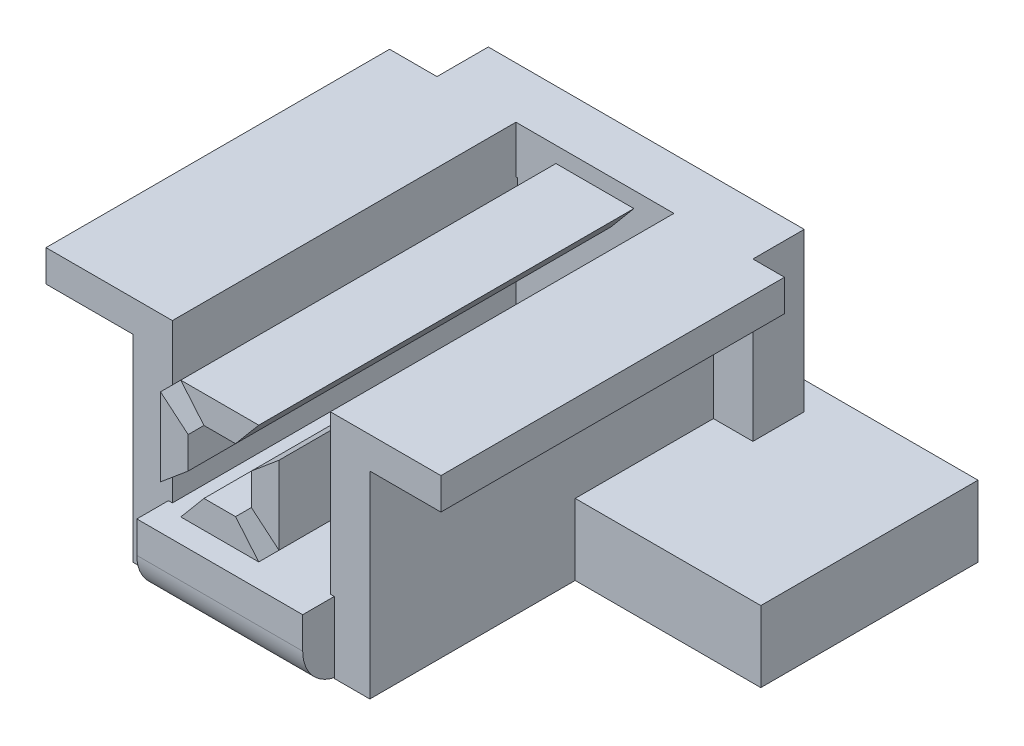
from build123d import *

# Parameters (mm, degrees)
BOSS_EXTRUDE2_DEPTH          = 8
BOSS_EXTRUDE2_DEPTH_BACK     = 1
SKETCH1_R                    = 2.5
CUT_EXTRUDE1_DEPTH           = 79.300702423
CUT_EXTRUDE1_DEPTH_BACK      = 79.300702423
SKETCH2_R                    = 2.5
SKETCH3_R                    = 3.25
CUT_EXTRUDE5_DEPTH           = 15
CUT_EXTRUDE5_DRAFT           = -0.0573
CUT_EXTRUDE5_PROFILE_2_DEPTH = 15
CUT_EXTRUDE5_PROFILE_2_DRAFT = -0.0573
SKETCH5_W                    = 4.5
SKETCH5_H                    = 6.5
BOSS_EXTRUDE3_DEPTH          = 14.5
SKETCH6_R                    = 4
CUT_EXTRUDE4_DEPTH           = 1.5
SKETCH12_W                   = 10.5
SKETCH12_H                   = 30
BOSS_EXTRUDE7_DEPTH          = 9
SKETCH15_W                   = 9
SKETCH15_H                   = 6.5
BOSS_EXTRUDE8_DEPTH          = 3.5
BOSS_EXTRUDE9_DEPTH          = 54
FILLET4_R                    = 5
SKETCH18_W                   = 9.873697418
SKETCH18_H                   = 6.5
BOSS_EXTRUDE11_DEPTH         = 0.5
SKETCH20_W                   = 4
SKETCH20_H                   = 17.5
BOSS_EXTRUDE12_DEPTH         = 18
BOSS_EXTRUDE13_DEPTH         = 11
BOSS_EXTRUDE13_DEPTH_BACK    = 4
SKETCH22_W                   = 17.5
SKETCH22_H                   = 4
SKETCH25_W                   = 2
SKETCH25_H                   = 17.5
BOSS_EXTRUDE14_DEPTH         = 41
SKETCH28_W                   = 41
SKETCH28_H                   = 45
BOSS_EXTRUDE15_DEPTH         = 2
SKETCH29_R                   = 1.75
CUT_EXTRUDE8_DEPTH           = 9
BOSS_EXTRUDE16_DEPTH         = 9
BOSS_EXTRUDE16_DEPTH_BACK    = 4
SKETCH30_W                   = 17.5
SKETCH30_H                   = 2
CUT_EXTRUDE9_DEPTH           = 9
SKETCH32_W                   = 13
SKETCH32_H                   = 4
BOSS_EXTRUDE17_DEPTH         = 23.5
SKETCH33_W                   = 0.5
SKETCH33_H                   = 17.5
BOSS_EXTRUDE18_DEPTH         = 20
SKETCH34_W                   = 4.5
SKETCH34_H                   = 25
SKETCH34_W_2                 = 15.5
SKETCH34_H_2                 = 4
SKETCH34_W_3                 = 9
BOSS_EXTRUDE19_DEPTH         = 26
SKETCH35_W                   = 9.873697418
SKETCH35_H                   = 0.5
BOSS_EXTRUDE20_DEPTH         = 47.5
BOSS_EXTRUDE21_DEPTH         = 47.5
SKETCH38_W                   = 0.419549816
SKETCH38_H                   = 18.5
CUT_EXTRUDE10_DEPTH          = 90.5
SKETCH39_W                   = 4
SKETCH39_H                   = 4
BOSS_EXTRUDE23_DEPTH         = 47.5
SKETCH46_W                   = 22.5
SKETCH46_H                   = 9
SKETCH46_W_2                 = 5
BOSS_EXTRUDE26_DEPTH         = 11.5
SKETCH47_W                   = 27.5
SKETCH47_H                   = 9
BOSS_EXTRUDE27_DEPTH         = 11
SKETCH48_W                   = 5
SKETCH48_H                   = 6.5
BOSS_EXTRUDE31_DEPTH         = 18.5
SKETCH50_R                   = 4
CUT_EXTRUDE11_DEPTH          = 1.5
SKETCH51_W                   = 9.626242636
SKETCH51_H                   = 9.125298808
BOSS_EXTRUDE32_DEPTH         = 1.5
BOSS_EXTRUDE35_DEPTH         = 47.5
SKETCH55_W                   = 9.873697418
SKETCH55_H                   = 0.5
CUT_EXTRUDE12_DEPTH          = 47.5
SKETCH56_W                   = 0.5
SKETCH56_H                   = 20
BOSS_EXTRUDE36_DEPTH         = 43.5
BOSS_EXTRUDE37_DEPTH         = 47.5
SKETCH58_W                   = 0.715052156
SKETCH58_H                   = 9.51279705
CUT_EXTRUDE13_DEPTH          = 4
CUT_EXTRUDE15_DEPTH          = 47.5
SKETCH60_W                   = 0.215052156
SKETCH60_H                   = 9.51279705
CUT_EXTRUDE16_DEPTH          = 47.5
CUT_EXTRUDE17_DEPTH          = 47.5
SKETCH62_W                   = 8
SKETCH62_H                   = 8
CUT_EXTRUDE18_DEPTH          = 47.5
SKETCH63_W                   = 13
SKETCH63_H                   = 4
CUT_EXTRUDE20_DEPTH          = 17
SKETCH64_W                   = 1
SKETCH64_H                   = 1.5
BOSS_EXTRUDE38_DEPTH         = 6.5
CUT_EXTRUDE22_DEPTH          = 9
FILLET6_R                    = 5
BOSS_EXTRUDE39_DEPTH         = 11
BOSS_EXTRUDE39_DEPTH_BACK    = 10
SKETCH67_W                   = 27.5
SKETCH67_H                   = 9
SKETCH68_W                   = 2
SKETCH68_H                   = 45
CUT_EXTRUDE23_DEPTH          = 17
SKETCH69_W                   = 2
SKETCH69_H                   = 41
CUT_EXTRUDE24_DEPTH          = 37
SKETCH70_W                   = 6
SKETCH70_H                   = 2.5
CUT_EXTRUDE25_DEPTH          = 6.5
SKETCH71_W                   = 40
SKETCH71_H                   = 6.5
BOSS_EXTRUDE40_DEPTH         = 1.5


with BuildPart() as part:
    # Sketch1 → Boss-Extrude2 (new, two sides: drawn at the far end of the back side and taken through both)
    with BuildSketch(Plane(origin=(0, 0, 0), x_dir=(1, 0, 0), z_dir=(0, 1, 0)).offset(-BOSS_EXTRUDE2_DEPTH_BACK)):
        with BuildLine():
            Line((5, 0), (50, 0))
            ThreePointArc((50, 0), (53.535533906, 1.464466094), (55, 5))
            Line((55, 5), (55, 50))
            ThreePointArc((55, 50), (53.535533906, 53.535533906), (50, 55))
            Line((50, 55), (5, 55))
            ThreePointArc((5, 55), (1.464466094, 53.535533906), (0, 50))
            Line((0, 50), (0, 5))
            ThreePointArc((0, 5), (1.464466094, 1.464466094), (5, 0))
        make_face()
        with Locations(Location((7.5, 47.5, 0), (0, 0, 270))):
            Circle(SKETCH1_R, mode=Mode.SUBTRACT)
        with Locations(Location((47.5, 47.5, 0), (0, 0, 270))):
            Circle(SKETCH1_R, mode=Mode.SUBTRACT)
        with Locations(Location((47.5, 7.5, 0), (0, 0, 270))):
            Circle(SKETCH1_R, mode=Mode.SUBTRACT)
        with Locations(Location((7.5, 7.5, 0), (0, 0, 270))):
            Circle(SKETCH1_R, mode=Mode.SUBTRACT)
    extrude(amount=BOSS_EXTRUDE2_DEPTH + BOSS_EXTRUDE2_DEPTH_BACK)

    # Sketch2 → Cut-Extrude1 (cut, two sides: drawn at the far end of the back side and taken through both)
    with BuildSketch(Plane(origin=(0, 8, 0), x_dir=(1, 0, 0), z_dir=(0, 1, 0)).offset(-CUT_EXTRUDE1_DEPTH_BACK)):
        with BuildLine():
            Line((0, 50), (0, 27.5))
            Line((0, 27.5), (55, 27.5))
            Line((55, 27.5), (55, 50))
            ThreePointArc((55, 50), (53.535533906, 53.535533906), (50, 55))
            Line((50, 55), (5, 55))
            ThreePointArc((5, 55), (1.464466094, 53.535533906), (0, 50))
        make_face()
        with Locations((7.5, 47.5)):
            Circle(SKETCH2_R, mode=Mode.SUBTRACT)
        with Locations((47.5, 47.5)):
            Circle(SKETCH2_R, mode=Mode.SUBTRACT)
    extrude(amount=CUT_EXTRUDE1_DEPTH + CUT_EXTRUDE1_DEPTH_BACK, mode=Mode.SUBTRACT)


with BuildPart() as cut_extrude5_tool:
    # Sketch3 → Cut-Extrude5 (with draft: the straight prism first)
    with BuildSketch(Plane(origin=(0, 0, -27.5), x_dir=(-1, 0, 0), z_dir=(0, 0, -1))):
        with Locations((-37.5, 3.5)):
            Circle(SKETCH3_R)
    extrude(amount=-CUT_EXTRUDE5_DEPTH)
    # Cut-Extrude5: the draft: its side faces are tilted about the plane it starts from
    cut_extrude5_sides = [cut_extrude5_tool.faces().sort_by_distance(p)[0] for p in [
        (40.75, 3.5, -20),
    ]]
    draft(cut_extrude5_sides, Plane(origin=(0, 0, -27.5), x_dir=(-1, 0, 0), z_dir=(0, 0, -1)), CUT_EXTRUDE5_DRAFT)


with BuildPart() as part_1:
    add(part.part)

    # Cut-Extrude5: cut by cut_extrude5_tool
    add(cut_extrude5_tool.part, mode=Mode.SUBTRACT)


with BuildPart() as cut_extrude5_profile_2_tool:
    # Sketch3 → Cut-Extrude5 profile 2 (with draft: the straight prism first)
    with BuildSketch(Plane(origin=(0, 0, -27.5), x_dir=(-1, 0, 0), z_dir=(0, 0, -1))):
        with Locations((-17.5, 3.5)):
            Circle(SKETCH3_R)
    extrude(amount=-CUT_EXTRUDE5_PROFILE_2_DEPTH)
    # Cut-Extrude5 profile 2: the draft: its side faces are tilted about the plane it starts from
    cut_extrude5_profile_2_sides = [cut_extrude5_profile_2_tool.faces().sort_by_distance(p)[0] for p in [
        (20.75, 3.5, -20),
    ]]
    draft(cut_extrude5_profile_2_sides, Plane(origin=(0, 0, -27.5), x_dir=(-1, 0, 0), z_dir=(0, 0, -1)), CUT_EXTRUDE5_PROFILE_2_DRAFT)


with BuildPart() as part_2:
    add(part_1.part)

    # Cut-Extrude5 profile 2: cut by cut_extrude5_profile_2_tool
    add(cut_extrude5_profile_2_tool.part, mode=Mode.SUBTRACT)

    # Sketch5 → Boss-Extrude3 (add)
    with BuildSketch(Plane(origin=(0, 8, 0), x_dir=(1, 0, 0), z_dir=(0, 1, 0))):
        with Locations((25.25, 20.75)):
            Rectangle(SKETCH5_W, SKETCH5_H)
        with Locations((29.75, 20.75)):
            Rectangle(SKETCH5_W, SKETCH5_H)
    extrude(amount=BOSS_EXTRUDE3_DEPTH)

    # Sketch6 → Cut-Extrude4 (cut)
    with BuildSketch(Plane(origin=(0, 0, -24), x_dir=(-1, 0, 0), z_dir=(0, 0, -1))):
        with Locations((-27.5, 17)):
            Circle(SKETCH6_R)
    extrude(amount=-CUT_EXTRUDE4_DEPTH, mode=Mode.SUBTRACT)

    # Sketch12 → Boss-Extrude7 (add)
    with BuildSketch(Plane(origin=(0, 8, 0), x_dir=(1, 0, 0), z_dir=(0, 1, 0))):
        with Locations((32.75, -15)):
            Rectangle(SKETCH12_W, SKETCH12_H)
        with Locations((22.25, -15)):
            Rectangle(SKETCH12_W, SKETCH12_H)
    extrude(amount=-BOSS_EXTRUDE7_DEPTH)

    # Sketch15 → Boss-Extrude8 (add)
    with BuildSketch(Plane(origin=(0, 22.5, 0), x_dir=(1, 0, 0), z_dir=(0, 1, 0))):
        with Locations((27.5, 20.75)):
            Rectangle(SKETCH15_W, SKETCH15_H)
    extrude(amount=BOSS_EXTRUDE8_DEPTH)

    # Sketch11 → Boss-Extrude9 (add)
    with BuildSketch(Plane(origin=(0, 0, -24), x_dir=(-1, 0, 0), z_dir=(0, 0, -1))):
        Polygon((-32.436848709, 26), (-29.5, 22.5), (-29.5, 26), align=None)
        Polygon((-29.5, 22.5), (-27.5, 22.5), (-25.5, 22.5), (-25.5, 26), (-29.5, 26), align=None)
        Polygon((-25.5, 26), (-25.5, 22.5), (-22.563151291, 26), align=None)
    extrude(amount=-BOSS_EXTRUDE9_DEPTH)

    # Fillet4
    fillet4_edges = [part_2.edges().sort_by_distance(p)[0] for p in [
        (27.5, -1, 30),
    ]]
    fillet(fillet4_edges, radius=FILLET4_R)

    # Sketch18 → Boss-Extrude11 (add)
    with BuildSketch(Plane(origin=(0, 26, 0), x_dir=(1, 0, 0), z_dir=(0, 1, 0))):
        with Locations((27.5, 20.75)):
            Rectangle(SKETCH18_W, SKETCH18_H)
    extrude(amount=BOSS_EXTRUDE11_DEPTH)

    # Sketch20 → Boss-Extrude12 (add)
    with BuildSketch(Plane(origin=(0, 8, 0), x_dir=(1, 0, 0), z_dir=(0, 1, 0))):
        with Locations((14.5, 8.75)):
            Rectangle(SKETCH20_W, SKETCH20_H)
        with Locations((40.5, 8.75)):
            Rectangle(SKETCH20_W, SKETCH20_H)
    extrude(amount=BOSS_EXTRUDE12_DEPTH)

    # Sketch22 → Boss-Extrude13 (add, two sides: drawn at the far end of the back side and taken through both)
    with BuildSketch(Plane.ZY.offset(-12.5).offset(-BOSS_EXTRUDE13_DEPTH_BACK)):
        with Locations((-8.75, 26)):
            Rectangle(SKETCH22_W, SKETCH22_H)
    extrude(amount=BOSS_EXTRUDE13_DEPTH + BOSS_EXTRUDE13_DEPTH_BACK)

    # Sketch25 → Boss-Extrude14 (add)
    with BuildSketch(Plane(origin=(0, 28, 0), x_dir=(1, 0, 0), z_dir=(0, 1, 0))):
        with Locations((2.5, 8.75)):
            Rectangle(SKETCH25_W, SKETCH25_H)
    extrude(amount=BOSS_EXTRUDE14_DEPTH)

    # Sketch28 → Boss-Extrude15 (add)
    with BuildSketch(Plane.ZY.offset(-1.5)):
        with Locations((-20.5, 46.5)):
            Rectangle(SKETCH28_W, SKETCH28_H)
    extrude(amount=-BOSS_EXTRUDE15_DEPTH)

    # Sketch29 → Cut-Extrude8 (cut)
    with BuildSketch(Plane.ZY.offset(-1.5)):
        with Locations((-36, 33)):
            Circle(SKETCH29_R)
        with Locations((-5, 64)):
            Circle(SKETCH29_R)
        with Locations((-5, 33)):
            Circle(SKETCH29_R)
        with Locations((-36, 64)):
            Circle(SKETCH29_R)
    extrude(amount=-CUT_EXTRUDE8_DEPTH, mode=Mode.SUBTRACT)

    # Sketch30 → Boss-Extrude16 (add, two sides: drawn at the far end of the back side and taken through both)
    with BuildSketch(Plane(origin=(42.5, 0, 0), x_dir=(0, 0, -1), z_dir=(1, 0, 0)).offset(-BOSS_EXTRUDE16_DEPTH_BACK)):
        with Locations((8.75, 25)):
            Rectangle(SKETCH30_W, SKETCH30_H)
        with Locations((8.75, 27)):
            Rectangle(SKETCH30_W, SKETCH30_H)
    extrude(amount=BOSS_EXTRUDE16_DEPTH + BOSS_EXTRUDE16_DEPTH_BACK)

    # Sketch31 → Cut-Extrude9 (cut)
    with BuildSketch(Plane(origin=(3.5, 0, 0), x_dir=(0, 0, -1), z_dir=(1, 0, 0))):
        with BuildLine():
            ThreePointArc((30.5, 47), (27.571067812, 54.071067812), (20.5, 57))
            Line((20.5, 57), (20.5, 47))
            Line((20.5, 47), (30.5, 47))
        make_face()
        with BuildLine():
            Line((20.5, 47), (20.5, 57))
            ThreePointArc((20.5, 57), (13.428932188, 39.928932188), (30.5, 47))
            Line((30.5, 47), (20.5, 47))
        make_face()
    extrude(amount=-CUT_EXTRUDE9_DEPTH, mode=Mode.SUBTRACT)

    # Sketch32 → Boss-Extrude17 (add)
    with BuildSketch(Plane(origin=(0, 0, -17.5), x_dir=(-1, 0, 0), z_dir=(0, 0, -1))):
        with Locations((-10, 26)):
            Rectangle(SKETCH32_W, SKETCH32_H)
    extrude(amount=BOSS_EXTRUDE17_DEPTH)

    # Sketch33 → Boss-Extrude18 (add)
    with BuildSketch(Plane(origin=(0, 8, 0), x_dir=(1, 0, 0), z_dir=(0, 1, 0))):
        with Locations((38.25, 8.75)):
            Rectangle(SKETCH33_W, SKETCH33_H)
        with Locations((16.75, 8.75)):
            Rectangle(SKETCH33_W, SKETCH33_H)
    extrude(amount=BOSS_EXTRUDE18_DEPTH)

    # Sketch34 → Boss-Extrude19 (add)
    with BuildSketch(Plane.XY):
        with Locations((14.75, 11.5)):
            Rectangle(SKETCH34_W, SKETCH34_H)
        with Locations((9.25, 26)):
            Rectangle(SKETCH34_W_2, SKETCH34_H_2)
        Polygon((42.5, 24), (42.5, 28), (38, 28), (38, 8), (38, -1), (42.5, -1), (42.5, 8), align=None)
        with Locations((47, 26)):
            Rectangle(SKETCH34_W_3, SKETCH34_H_2)
    extrude(amount=BOSS_EXTRUDE19_DEPTH)

    # Sketch35 → Boss-Extrude20 (add)
    with BuildSketch(Plane.XY.offset(-17.5)):
        with Locations((27.5, 26.25)):
            Rectangle(SKETCH35_W, SKETCH35_H)
    extrude(amount=BOSS_EXTRUDE20_DEPTH)

    # Sketch37 → Boss-Extrude21 (add)
    with BuildSketch(Plane.XY.offset(-17.5)):
        Polygon((23, 8), (25.5, 8), (25.5, 12), (23, 9.020616019), align=None)
        Polygon((25.5, 8), (27.5, 8), (29.5, 8), (29.5, 12), (25.5, 12), align=None)
        Polygon((29.5, 12), (29.5, 8), (32, 8), (32, 9.020616019), align=None)
        Polygon((29.5, 8), (27.5, 8), (25.5, 8), (23, 8), (23, 9.020616019), (21.863844179, 7.666598237), (33.136155821, 7.666598237), (32, 9.020616019), (32, 8), align=None)
    extrude(amount=BOSS_EXTRUDE21_DEPTH)

    # Sketch38 → Cut-Extrude10 (cut)
    with BuildSketch(Plane.XY.offset(30)):
        with Locations((22.353376383, 17.25)):
            Rectangle(SKETCH38_W, SKETCH38_H)
        with Locations((32.646623617, 17.25)):
            Rectangle(SKETCH38_W, SKETCH38_H)
    extrude(amount=-CUT_EXTRUDE10_DEPTH, mode=Mode.SUBTRACT)

    # Sketch39 → Boss-Extrude23 (add)
    with BuildSketch(Plane.XY.offset(30)):
        Polygon((21, 19.25), (17.715052156, 22.006398525), (17, 22.006398525), (17, 19.25), align=None)
        with Locations((19, 17.25)):
            Rectangle(SKETCH39_W, SKETCH39_H)
        Polygon((17.715052156, 12.493601475), (21, 15.25), (17, 15.25), (17, 12.493601475), align=None)
        Polygon((37.284947844, 12.493601475), (38, 12.493601475), (38, 15.25), (34, 15.25), align=None)
        Polygon((38, 17.25), (38, 19.25), (34, 19.25), (34, 15.25), (38, 15.25), align=None)
        Polygon((38, 19.25), (38, 22.006398525), (37.284947844, 22.006398525), (34, 19.25), align=None)
    extrude(amount=-BOSS_EXTRUDE23_DEPTH)

    # Sketch46 → Boss-Extrude26 (add)
    with BuildSketch(Plane.ZY):
        with Locations((-16.25, 3.5)):
            Rectangle(SKETCH46_W, SKETCH46_H)
        with Locations((-2.5, 3.5)):
            Rectangle(SKETCH46_W_2, SKETCH46_H)
    extrude(amount=-BOSS_EXTRUDE26_DEPTH)

    # Sketch47 → Boss-Extrude27 (add)
    with BuildSketch(Plane.ZY):
        with Locations((-13.75, 3.5)):
            Rectangle(SKETCH47_W, SKETCH47_H)
    extrude(amount=BOSS_EXTRUDE27_DEPTH)

    # Sketch48 → Boss-Extrude31 (add)
    with BuildSketch(Plane(origin=(0, 8, 0), x_dir=(1, 0, 0), z_dir=(0, 1, 0))):
        Polygon((42.5, 17.5), (42.5, 24), (32, 24), (32, 17.5), (32.436848709, 17.5), (38, 17.5), align=None)
        with Locations((45, 20.75)):
            Rectangle(SKETCH48_W, SKETCH48_H)
        Polygon((12.5, 24), (12.5, 17.5), (17, 17.5), (22.563151291, 17.5), (23, 17.5), (23, 24), align=None)
        with Locations((10, 20.75)):
            Rectangle(SKETCH48_W, SKETCH48_H)
    extrude(amount=BOSS_EXTRUDE31_DEPTH)

    # Sketch50 → Cut-Extrude11 (cut)
    with BuildSketch(Plane(origin=(0, 0, -24), x_dir=(-1, 0, 0), z_dir=(0, 0, -1))):
        with Locations((-17.5, 17)):
            Circle(SKETCH50_R)
        with Locations((-37.5, 17)):
            Circle(SKETCH50_R)
    extrude(amount=-CUT_EXTRUDE11_DEPTH, mode=Mode.SUBTRACT)

    # Sketch51 → Boss-Extrude32 (add)
    with BuildSketch(Plane(origin=(0, 0, -24), x_dir=(-1, 0, 0), z_dir=(0, 0, -1))):
        with Locations((-27.646184708, 17.114099589)):
            Rectangle(SKETCH51_W, SKETCH51_H)
    extrude(amount=-BOSS_EXTRUDE32_DEPTH)

    # Sketch54 → Boss-Extrude35 (add)
    with BuildSketch(Plane.XY.offset(-17.5)):
        Polygon((29.5, 22.5), (27.5, 22.5), (27.5, 14.5), (31.5, 14.5), (31.5, 22.5), align=None)
        Polygon((27.5, 14.5), (27.5, 22.5), (25.5, 22.5), (23.5, 22.5), (23.5, 14.5), align=None)
    extrude(amount=BOSS_EXTRUDE35_DEPTH)

    # Sketch55 → Cut-Extrude12 (cut)
    with BuildSketch(Plane.XY.offset(30)):
        with Locations((27.5, 26.25)):
            Rectangle(SKETCH55_W, SKETCH55_H)
    extrude(amount=-CUT_EXTRUDE12_DEPTH, mode=Mode.SUBTRACT)

    # Sketch56 → Boss-Extrude36 (add)
    with BuildSketch(Plane.XY.offset(26)):
        with Locations((37.75, 18)):
            Rectangle(SKETCH56_W, SKETCH56_H)
        with Locations((17.25, 18)):
            Rectangle(SKETCH56_W, SKETCH56_H)
    extrude(amount=-BOSS_EXTRUDE36_DEPTH)

    # Sketch57 → Boss-Extrude37 (add)
    with BuildSketch(Plane.XY.offset(30)):
        Polygon((35, 23.436848709), (31.5, 20.5), (31.5, 20.428787517), (35, 20.428787517), align=None)
        Polygon((35, 20.428787517), (31.5, 20.428787517), (31.5, 18.5), (35, 18.5), (35, 18.535606241), align=None)
        Polygon((35, 18.5), (31.5, 18.5), (31.5, 16.5), (35, 16.5), (35, 18.464393759), align=None)
        Polygon((35, 16.5), (31.5, 16.5), (35, 13.563151291), align=None)
        Polygon((32.436848709, 11), (29.5, 14.5), (25.5, 14.5), (22.563151291, 11), align=None)
        Polygon((20, 16.5), (23.5, 16.5), (23.5, 18.5), (23.5, 20.5), (20, 23.436848709), (20, 18.535606241), (20, 18.464393759), align=None)
        Polygon((20, 13.563151291), (23.5, 16.5), (20, 16.5), align=None)
    extrude(amount=-BOSS_EXTRUDE37_DEPTH)

    # Sketch58 → Cut-Extrude13 (cut)
    with BuildSketch(Plane.XY.offset(30)):
        with Locations((37.642473922, 17.25)):
            Rectangle(SKETCH58_W, SKETCH58_H)
        with Locations((17.357526078, 17.25)):
            Rectangle(SKETCH58_W, SKETCH58_H)
    extrude(amount=-CUT_EXTRUDE13_DEPTH, mode=Mode.SUBTRACT)

    # Sketch59 → Cut-Extrude15 (cut)
    with BuildSketch(Plane.XY.offset(30)):
        Polygon((37.284947844, 22.006398525), (35, 20.089099631), (35, 14.410900369), (37.284947844, 12.493601475), align=None)
        Polygon((17.715052156, 22.006398525), (20, 20.089099631), (20, 14.410900369), (17.715052156, 12.493601475), align=None)
    extrude(amount=-CUT_EXTRUDE15_DEPTH, mode=Mode.SUBTRACT)

    # Sketch60 → Cut-Extrude16 (cut)
    with BuildSketch(Plane.XY.offset(26)):
        with Locations((37.392473922, 17.25)):
            Rectangle(SKETCH60_W, SKETCH60_H)
        with Locations((17.607526078, 17.25)):
            Rectangle(SKETCH60_W, SKETCH60_H)
    extrude(amount=-CUT_EXTRUDE16_DEPTH, mode=Mode.SUBTRACT)

    # Sketch61 → Cut-Extrude17 (cut)
    with BuildSketch(Plane.XY.offset(30)):
        Polygon((32.436848709, 8), (22.563151291, 8), (22.563151291, 8.5), (24.660900369, 11), (30.339099631, 11), (32.436848709, 8.5), align=None)
    extrude(amount=-CUT_EXTRUDE17_DEPTH, mode=Mode.SUBTRACT)

    # Sketch62 → Cut-Extrude18 (cut)
    with BuildSketch(Plane.XY.offset(30)):
        with Locations((27.5, 18.5)):
            Rectangle(SKETCH62_W, SKETCH62_H)
    extrude(amount=-CUT_EXTRUDE18_DEPTH, mode=Mode.SUBTRACT)

    # Sketch63 → Cut-Extrude20 (cut)
    with BuildSketch(Plane(origin=(0, 0, -41), x_dir=(-1, 0, 0), z_dir=(0, 0, -1))):
        with Locations((-10, 26)):
            Rectangle(SKETCH63_W, SKETCH63_H)
    extrude(amount=-CUT_EXTRUDE20_DEPTH, mode=Mode.SUBTRACT)

    # Sketch64 → Boss-Extrude38 (add)
    with BuildSketch(Plane(origin=(0, 0, -17.5), x_dir=(-1, 0, 0), z_dir=(0, 0, -1))):
        with Locations((-17, 27.25)):
            Rectangle(SKETCH64_W, SKETCH64_H)
    extrude(amount=BOSS_EXTRUDE38_DEPTH)

    # Sketch65 → Cut-Extrude22 (cut)
    with BuildSketch(Plane(origin=(0, 8, 0), x_dir=(1, 0, 0), z_dir=(0, 1, 0))):
        Polygon((-11, 27.5), (-11, 0), (0, 0), (0, 7.5), (0, 27.5), align=None)
        with BuildLine():
            ThreePointArc((5, 7.5), (5.732233047, 5.732233047), (7.5, 5))
            Line((7.5, 5), (7.5, 7.5))
            Line((7.5, 7.5), (5, 7.5))
        make_face()
        with BuildLine():
            Line((7.5, 7.5), (7.5, 5))
            ThreePointArc((7.5, 5), (9.267766953, 5.732233047), (10, 7.5))
            ThreePointArc((10, 7.5), (7.5, 10), (5, 7.5))
            Line((5, 7.5), (7.5, 7.5))
        make_face()
    extrude(amount=-CUT_EXTRUDE22_DEPTH, mode=Mode.SUBTRACT)

    # Fillet6
    fillet6_edges = [part_2.edges().sort_by_distance(p)[0] for p in [
        (0, 3.5, 0),
    ]]
    fillet(fillet6_edges, radius=FILLET6_R)

    # Sketch67 → Boss-Extrude39 (add, two sides: drawn at the far end of the back side and taken through both)
    with BuildSketch(Plane(origin=(55, 0, 0), x_dir=(0, 0, -1), z_dir=(1, 0, 0)).offset(-BOSS_EXTRUDE39_DEPTH_BACK)):
        with Locations((13.75, 3.5)):
            Rectangle(SKETCH67_W, SKETCH67_H)
    extrude(amount=BOSS_EXTRUDE39_DEPTH + BOSS_EXTRUDE39_DEPTH_BACK)

    # Sketch68 → Cut-Extrude23 (cut)
    with BuildSketch(Plane(origin=(0, 0, -41), x_dir=(-1, 0, 0), z_dir=(0, 0, -1))):
        with Locations((-2.5, 46.5)):
            Rectangle(SKETCH68_W, SKETCH68_H)
    extrude(amount=-CUT_EXTRUDE23_DEPTH, mode=Mode.SUBTRACT)

    # Sketch69 → Cut-Extrude24 (cut)
    with BuildSketch(Plane(origin=(0, 0, -24), x_dir=(-1, 0, 0), z_dir=(0, 0, -1))):
        with Locations((-2.5, 48.5)):
            Rectangle(SKETCH69_W, SKETCH69_H)
    extrude(amount=-CUT_EXTRUDE24_DEPTH, mode=Mode.SUBTRACT)

    # Sketch70 → Cut-Extrude25 (cut)
    with BuildSketch(Plane(origin=(0, 0, -24), x_dir=(-1, 0, 0), z_dir=(0, 0, -1))):
        Polygon((-17.5, 28), (-17.5, 26.5), (-7.5, 26.5), (-1.5, 26.5), (-1.5, 28), align=None)
        with Locations((-4.5, 25.25)):
            Rectangle(SKETCH70_W, SKETCH70_H)
    extrude(amount=-CUT_EXTRUDE25_DEPTH, mode=Mode.SUBTRACT)

    # Sketch71 → Boss-Extrude40 (add)
    with BuildSketch(Plane(origin=(0, 26.5, 0), x_dir=(1, 0, 0), z_dir=(0, 1, 0))):
        with Locations((27.5, 20.75)):
            Rectangle(SKETCH71_W, SKETCH71_H)
    extrude(amount=BOSS_EXTRUDE40_DEPTH)


solid = part_2.part
